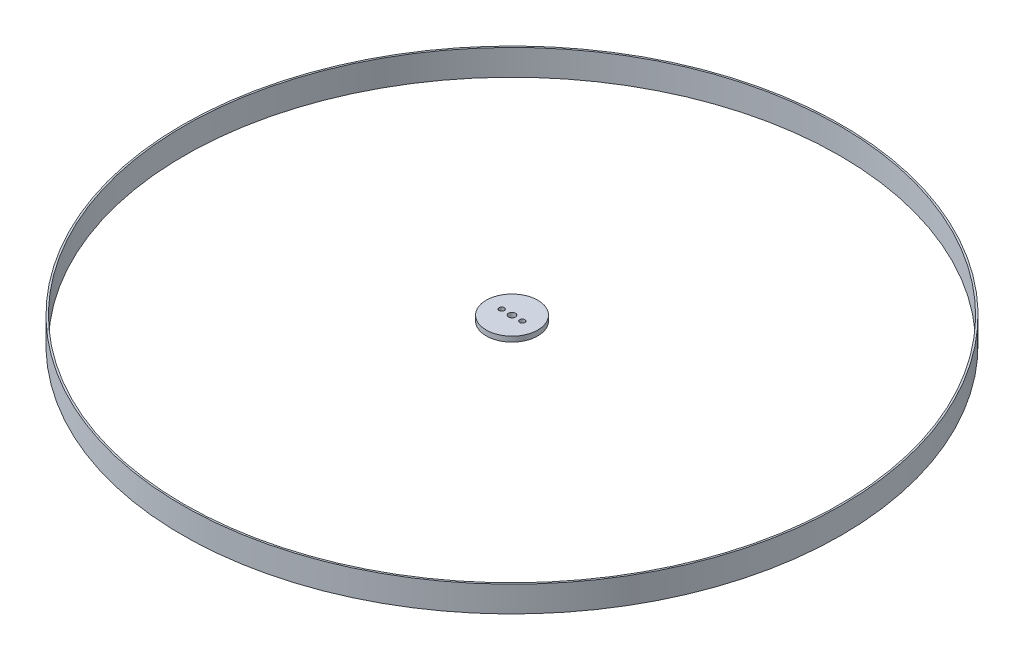
from build123d import *

# Parameters (mm, degrees)
SKETCH1_R           = 15
SKETCH1_R_2         = 1.5
SKETCH1_R_3         = 2
BOSS_EXTRUDE1_DEPTH = 3
SKETCH3_R           = 191.5
SKETCH3_R_2         = 190.5
EXTRUDE_THIN3_DEPTH = 15


with BuildPart() as part:
    # Sketch1 → Boss-Extrude1 (new body)
    with BuildSketch(Plane(origin=(0, 0, 0), x_dir=(1, 0, 0), z_dir=(0, 1, 0))):
        with Locations(Location((0, 0, 0), (0, 0, 270))):
            Circle(SKETCH1_R)
        with Locations(Location((-6, 0, 0), (0, 0, 270))):
            Circle(SKETCH1_R_2, mode=Mode.SUBTRACT)
        with Locations(Location((6, 0, 0), (0, 0, 270))):
            Circle(SKETCH1_R_2, mode=Mode.SUBTRACT)
        with Locations(Location((0, 0, 0), (0, 0, 270))):
            Circle(SKETCH1_R_3, mode=Mode.SUBTRACT)
    extrude(amount=BOSS_EXTRUDE1_DEPTH)


with BuildPart() as body_2:
    # Sketch3 → Extrude-Thin3 (new body)
    with BuildSketch(Plane(origin=(0, 3, 0), x_dir=(1, 0, 0), z_dir=(0, 1, 0))):
        Circle(SKETCH3_R)
        Circle(SKETCH3_R_2, mode=Mode.SUBTRACT)
    extrude(amount=-EXTRUDE_THIN3_DEPTH)


solid = Compound([part.part, body_2.part])
